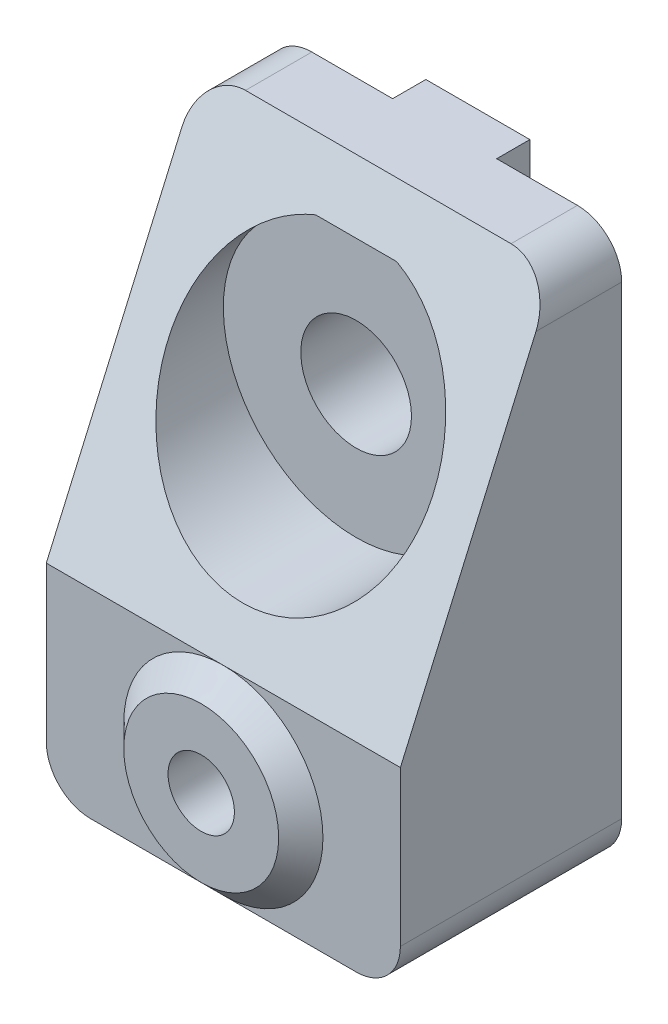
from build123d import *

# Parameters (mm, degrees)
BOSS_EXTRU_1_DEPTH           = 8
BOSS_EXTRU_1_DEPTH_BACK      = 17
ENL_V_MAT_EXTRU_1_DEPTH      = 22.836729465
ENL_V_MAT_EXTRU_1_DEPTH_BACK = 22.836729465
ESQUISSE2_R                  = 2.5
ENL_V_START                  = 4
ESQUISSE3_R                  = 6
ENL_V_MAT_EXTRU_2_DEPTH      = 18.283796654
ESQUISSE5_W                  = 1.5
ESQUISSE5_H                  = 4
ENL_V_MAT_EXTRU_3_DEPTH      = 23.273807488
ESQUISSE6_R                  = 4.5
BOSS_EXTRU_2_DEPTH           = 1
BOSS_EXTRU_2_TAPER           = 45
ESQUISSE7_R                  = 1.5
ENL_V_MAT_EXTRU_4_DEPTH      = 23.566568193
CONG_1_R                     = 2
ENL_V_MAT_EXTRU_5_DEPTH      = 26.806975801


with BuildPart() as part:
    # Esquisse1 → Boss.-Extru.1 (new, two sides: drawn at the far end of the back side and taken through both)
    with BuildSketch(Plane(origin=(0, 0, 0), x_dir=(1, 0, 0), z_dir=(0, 1, 0)).offset(-BOSS_EXTRU_1_DEPTH_BACK)):
        Polygon((2.35, 0), (8, 0), (8, -10), (-8, -10), (-8, 0), (-2.35, 0), (-2.35, 1.5), (2.35, 1.5), align=None)
    extrude(amount=BOSS_EXTRU_1_DEPTH + BOSS_EXTRU_1_DEPTH_BACK)

    # Esquisse2 → Enlèv. mat.-Extru.1 (cut, two sides: drawn at the far end of the back side and taken through both)
    with BuildSketch(Plane(origin=(-1.372446517, 0, 0), x_dir=(1, 0, 0), z_dir=(0, 0, 1)).offset(-ENL_V_MAT_EXTRU_1_DEPTH_BACK)):
        with Locations((1.372446517, 0)):
            Circle(ESQUISSE2_R)
    extrude(amount=ENL_V_MAT_EXTRU_1_DEPTH + ENL_V_MAT_EXTRU_1_DEPTH_BACK, mode=Mode.SUBTRACT)

    # Esquisse3 → Enlèv. mat.-Extru.2 (cut, through all)
    with BuildSketch(Plane.XY.offset(ENL_V_START)):
        Circle(ESQUISSE3_R)
    extrude(amount=ENL_V_MAT_EXTRU_2_DEPTH, mode=Mode.SUBTRACT)

    # Esquisse5 → Enlèv. mat.-Extru.3 (cut, through all)
    with BuildSketch(Plane.ZY.offset(2.35)):
        with Locations((-0.75, 0)):
            Rectangle(ESQUISSE5_W, ESQUISSE5_H)
    extrude(amount=-ENL_V_MAT_EXTRU_3_DEPTH, mode=Mode.SUBTRACT)

    # Esquisse6 → Boss.-Extru.2 (add)
    with BuildSketch(Plane.XY.offset(10)):
        with Locations((0, -12.5)):
            Circle(ESQUISSE6_R)
    extrude(amount=BOSS_EXTRU_2_DEPTH, taper=BOSS_EXTRU_2_TAPER)

    # Esquisse7 → Enlèv. mat.-Extru.4 (cut, through all)
    with BuildSketch(Plane.XY.offset(11)):
        with Locations((0, -12.5)):
            Circle(ESQUISSE7_R)
    extrude(amount=-ENL_V_MAT_EXTRU_4_DEPTH, mode=Mode.SUBTRACT)

    # Congé1
    cong_1_edges = [part.edges().sort_by_distance(p)[0] for p in [
        (-8, -17, 5),
        (8, -17, 5),
        (-8, 8, 5),
        (8, 8, 5),
    ]]
    fillet(cong_1_edges, radius=CONG_1_R)

    # Esquisse8 → Enlèv. mat.-Extru.5 (cut, through all)
    with BuildSketch(Plane.ZY.offset(8)):
        Polygon((3, 8), (10, -8), (10, 8), align=None)
    extrude(amount=-ENL_V_MAT_EXTRU_5_DEPTH, mode=Mode.SUBTRACT)


solid = part.part
